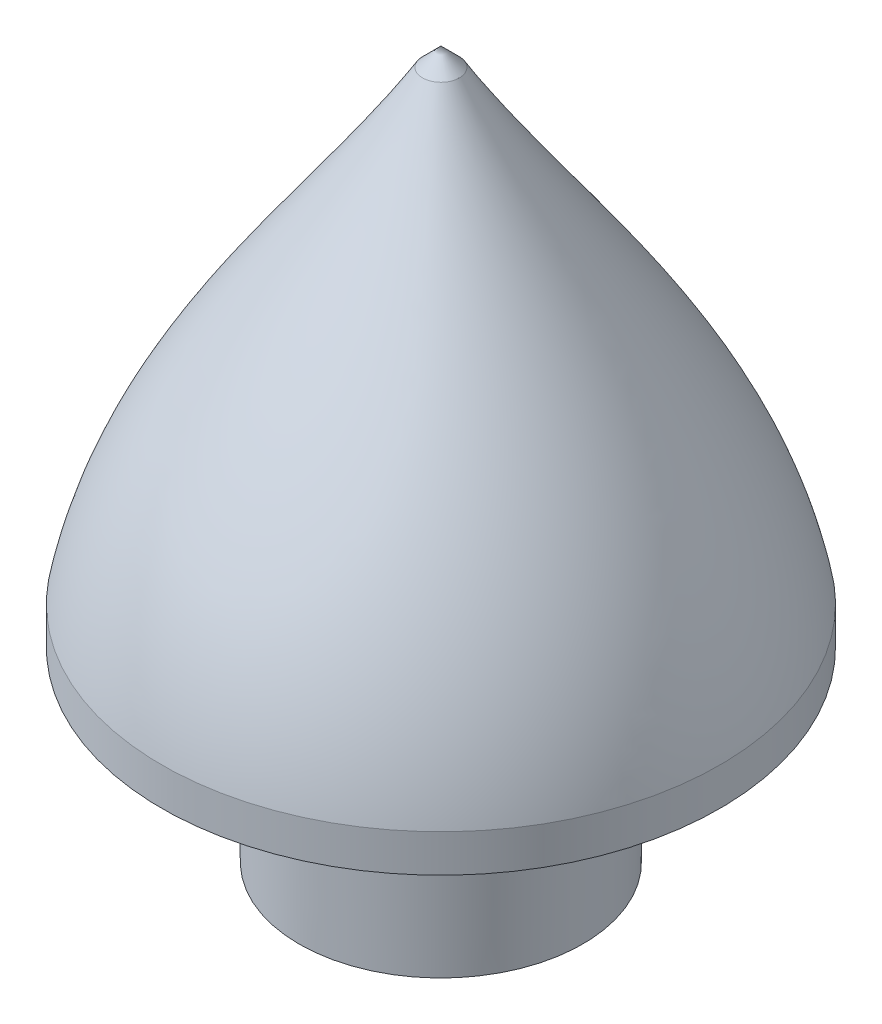
from build123d import *

# Parameters (mm, degrees)
SKETCH2_R           = 2.1
CUT_EXTRUDE1_DEPTH  = 2
SKETCH4_R           = 1.95
BOSS_EXTRUDE2_DEPTH = 2.5
BOSS_EXTRUDE2_TAPER = 1


with BuildPart() as part:
    # Sketch1 → Revolve1 (revolve)
    with BuildSketch(Plane.XY, mode=Mode.PRIVATE) as revolve1_sk:
        with BuildLine():
            Line((0, -2), (-2, -2))
            Line((-2, -2), (-2, 0))
            Line((-2, 0), (-3.75, 0))
            Line((-3.75, 0), (-3.75, 0.506327417))
            add(Edge.make_bspline(
                [(-0.247423506, 6.752576494), (-1.479776467, 4.708862861), (-3.282918319, 2.94887927), (-3.75, 0.506327417)],
                knots=[0, 0, 0, 0, 1, 1, 1, 1], degree=3))
            Line((-0.247423506, 6.752576494), (0, 7))
            Line((0, 7), (0, -2))
        make_face()
    revolve(revolve1_sk.sketch.rotate(Axis((0, -2, 0), (0, 1, 0)), 270), axis=Axis((0, -2, 0), (0, 1, 0)))

    # Sketch2 → Cut-Extrude1 (cut)
    with BuildSketch(Plane.XZ.offset(2)):
        Circle(SKETCH2_R)
    extrude(amount=-CUT_EXTRUDE1_DEPTH, mode=Mode.SUBTRACT)

    # Sketch4 → Boss-Extrude2 (add)
    with BuildSketch(Plane.XZ):
        Circle(SKETCH4_R)
    extrude(amount=BOSS_EXTRUDE2_DEPTH, taper=BOSS_EXTRUDE2_TAPER)


solid = part.part
